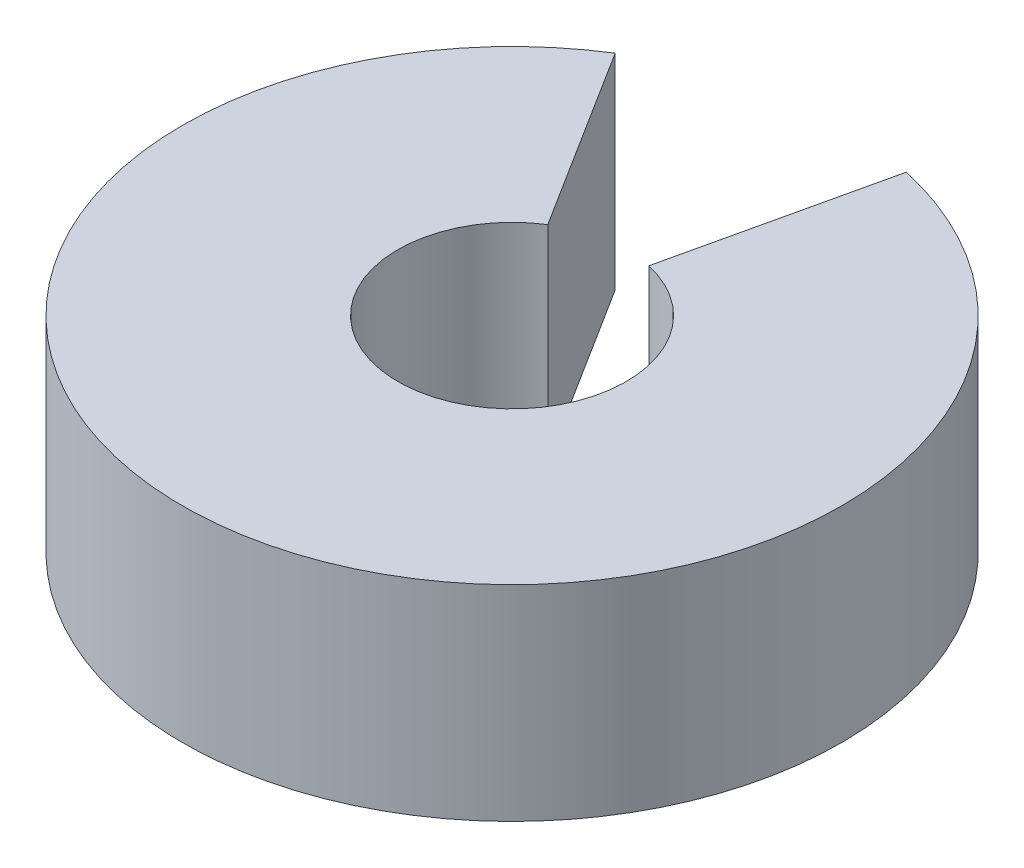
from build123d import *

# Parameters (mm, degrees)
SKETCH1_R           = 11.25
BOSS_EXTRUDE1_DEPTH = 7
SKETCH2_R           = 3.9
CUT_EXTRUDE1_DEPTH  = 7
CUT_EXTRUDE2_DEPTH  = 7


with BuildPart() as part:
    # Sketch1 → Boss-Extrude1 (new body)
    with BuildSketch(Plane(origin=(0, 0, 0), x_dir=(1, 0, 0), z_dir=(0, 1, 0))):
        Circle(SKETCH1_R)
    extrude(amount=BOSS_EXTRUDE1_DEPTH)

    # Sketch2 → Cut-Extrude1 (cut)
    with BuildSketch(Plane(origin=(0, 7, 0), x_dir=(1, 0, 0), z_dir=(0, 1, 0))):
        Circle(SKETCH2_R)
    extrude(amount=-CUT_EXTRUDE1_DEPTH, mode=Mode.SUBTRACT)

    # Sketch3 → Cut-Extrude2 (cut)
    with BuildSketch(Plane(origin=(0, 7, 0), x_dir=(1, 0, 0), z_dir=(0, 1, 0))):
        with BuildLine():
            ThreePointArc((-2.079150674, 3.299565498), (-0.658195703, 3.844057546), (0.862963598, 3.803326679))
            Line((0.862963598, 3.803326679), (2.48931807, 10.971134652))
            ThreePointArc((2.48931807, 10.971134652), (-1.898641451, 11.088627536), (-5.997550022, 9.517977397))
            Line((-5.997550022, 9.517977397), (-2.079150674, 3.299565498))
        make_face()
    extrude(amount=-CUT_EXTRUDE2_DEPTH, mode=Mode.SUBTRACT)


solid = part.part
